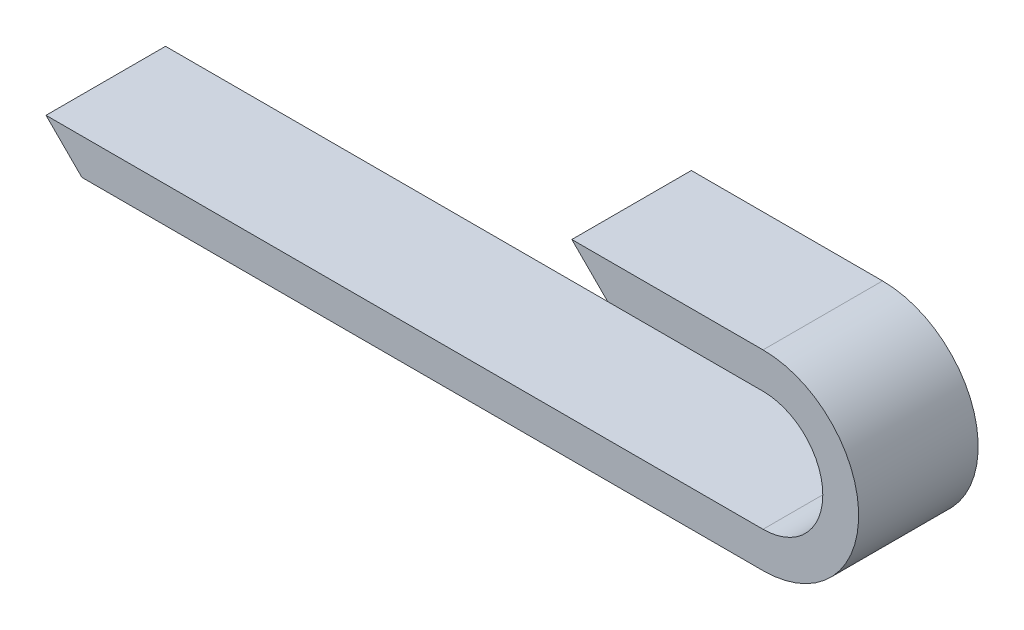
from build123d import *

# Parameters (mm, degrees)
EXTRUDE_1_DEPTH = 50
SCALE_1_SCALE   = 1.7


with BuildPart() as part:
    # 草图1 → 凸台-拉伸1 (new body)
    with BuildSketch(Plane.XY):
        with BuildLine():
            Line((111.300105962, 44.956400142), (126.300105962, 29.956400142))
            Line((126.300105962, 29.956400142), (191.300105962, 29.956400142))
            ThreePointArc((191.300105962, 29.956400142), (216.300105962, 4.956400142), (191.300105962, -20.043599858))
            Line((191.300105962, -20.043599858), (-108.699894038, -20.043599858))
            Line((-108.699894038, -20.043599858), (-93.699894038, -35.043599858))
            Line((-93.699894038, -35.043599858), (191.300105962, -35.043599858))
            ThreePointArc((191.300105962, -35.043599858), (231.300105962, 4.956400142), (191.300105962, 44.956400142))
            Line((191.300105962, 44.956400142), (111.300105962, 44.956400142))
        make_face()
    extrude(amount=-EXTRUDE_1_DEPTH)


with BuildPart() as part_1:
    # 缩放比例1: scaled about (0, 0, 0)
    add(part.part.scale(SCALE_1_SCALE))


solid = part_1.part
